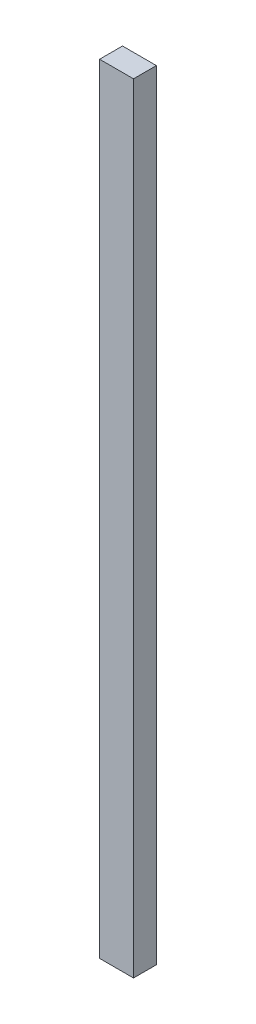
from build123d import *

# Parameters (mm, degrees)
SKETCH1_W           = 4.699
SKETCH1_H           = 3.175
BOSS_EXTRUDE1_DEPTH = 107.95


with BuildPart() as part:
    # Sketch1 → Boss-Extrude1 (new body)
    with BuildSketch(Plane(origin=(0, 0, 0), x_dir=(1, 0, 0), z_dir=(0, 1, 0))):
        Rectangle(SKETCH1_W, SKETCH1_H)
    extrude(amount=BOSS_EXTRUDE1_DEPTH)


solid = part.part
